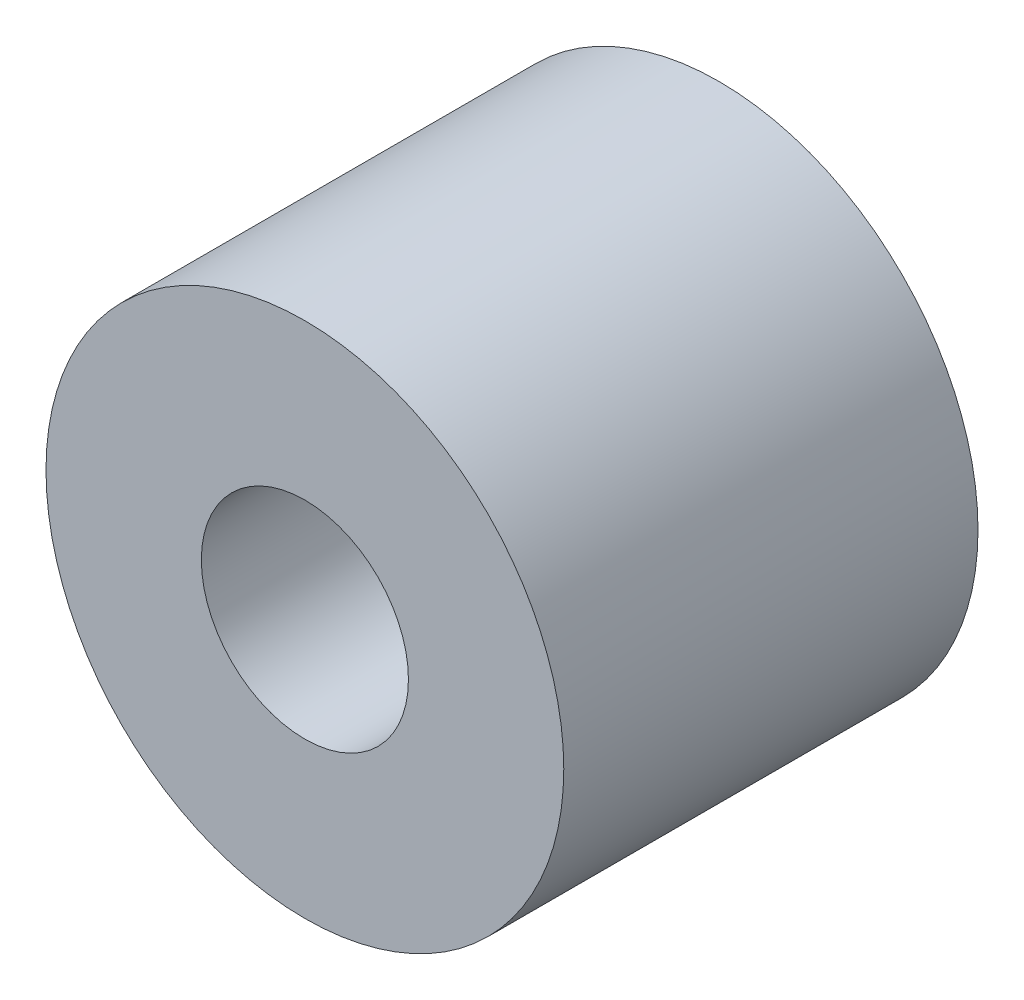
from build123d import *

# Parameters (mm, degrees)
SKETCH1_R           = 25
SKETCH1_R_2         = 10
BOSS_EXTRUDE1_DEPTH = 40


with BuildPart() as part:
    # Sketch1 → Boss-Extrude1 (new body)
    with BuildSketch(Plane.XY):
        Circle(SKETCH1_R)
        Circle(SKETCH1_R_2, mode=Mode.SUBTRACT)
    extrude(amount=BOSS_EXTRUDE1_DEPTH)


solid = part.part
